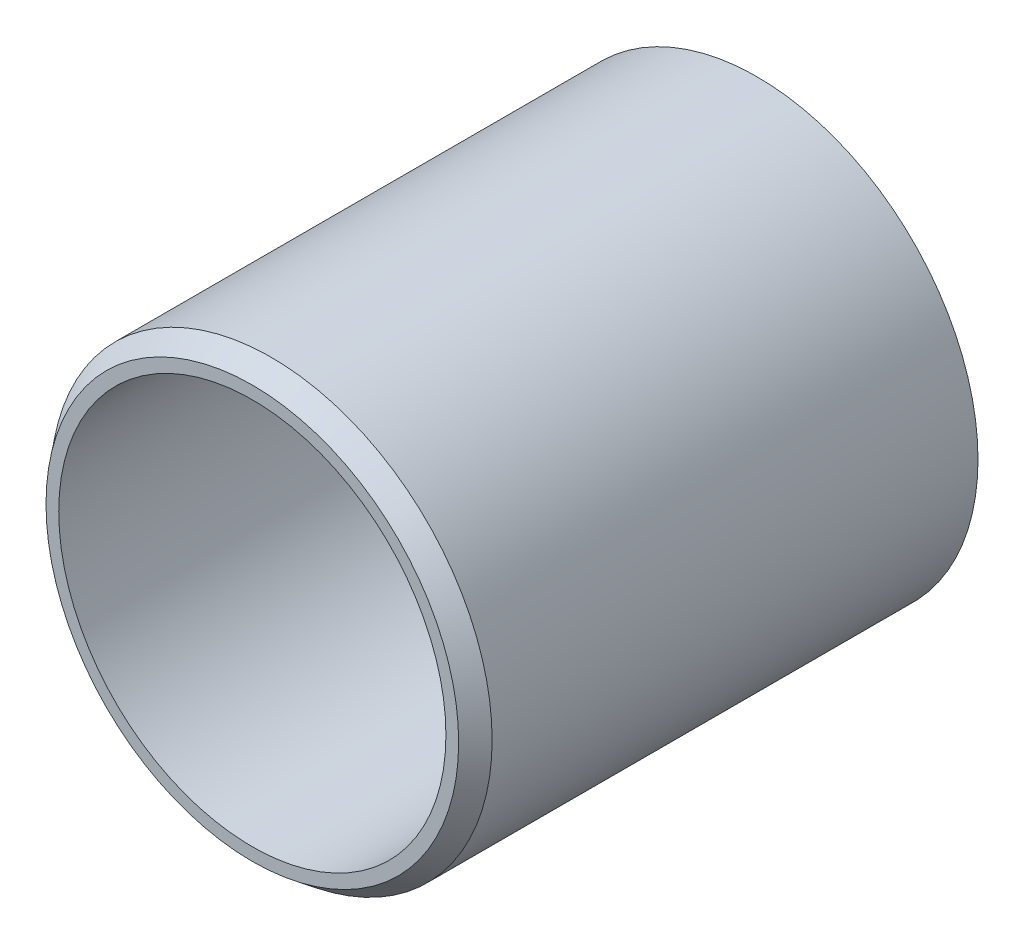
from build123d import *

# Parameters (mm, degrees)
SKETCH1_R      = 44.45
SKETCH1_R_2    = 38.9636
EXTRUDE1_DEPTH = 50.8
CHAMFER4_SIZE  = 3.81
CHAMFER4_SIZE2 = 2.923515824


with BuildPart() as part:
    # Sketch1 → Extrude1 (new, symmetric)
    with BuildSketch(Plane.XY):
        Circle(SKETCH1_R)
        Circle(SKETCH1_R_2, mode=Mode.SUBTRACT)
    extrude(amount=EXTRUDE1_DEPTH, both=True)

    # Chamfer4
    chamfer4_edges = [part.edges().sort_by_distance(p)[0] for p in [
        (-44.45, 0, 50.8),
    ]]
    chamfer4_side = [part.faces().sort_by_distance(p)[0] for p in [
        (-44.45, 0, 0),
    ]]
    chamfer(chamfer4_edges, length=CHAMFER4_SIZE, length2=CHAMFER4_SIZE2, reference=chamfer4_side[0])


solid = part.part
